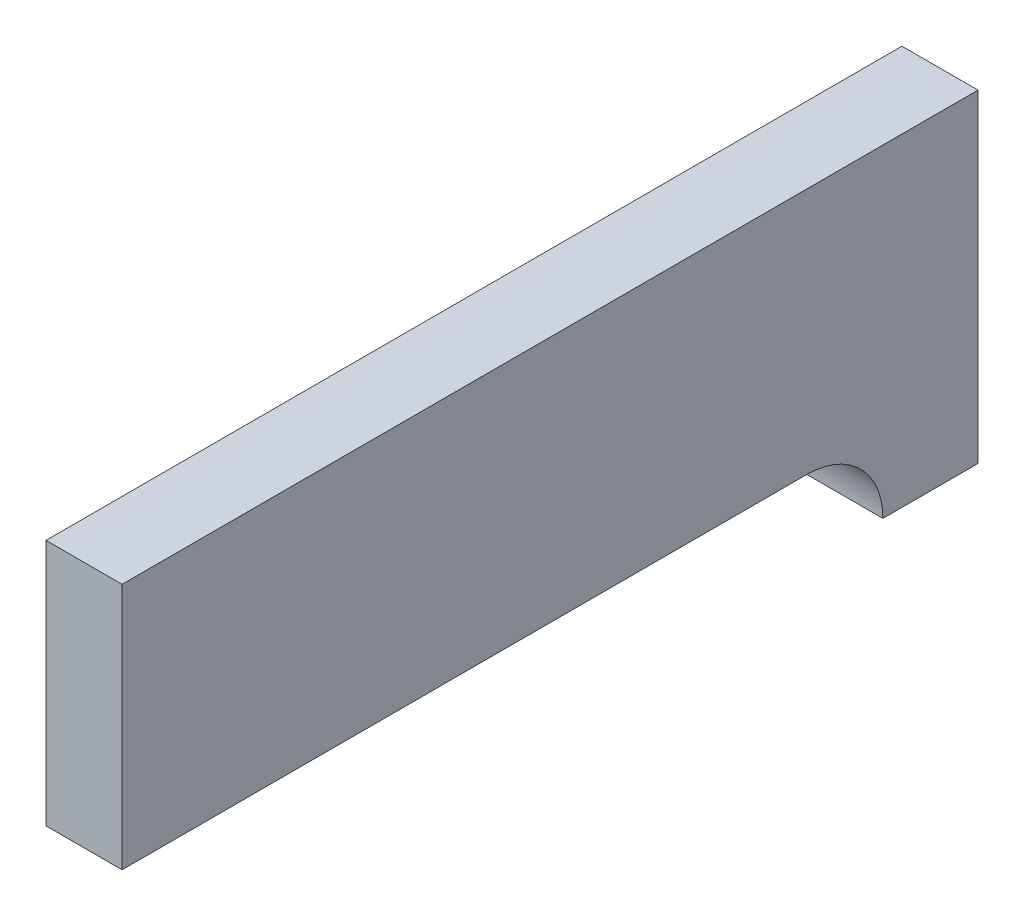
from build123d import *

# Parameters (mm, degrees)
SKETCH1_W            = 48
SKETCH1_H            = 53
BOSS_EXTRUDE1_DEPTH  = 10
SKETCH2_W            = 48
SKETCH2_H            = 5.616325
BOSS_EXTRUDE2_DEPTH  = 33.1917878
SKETCH4_W            = 4
SKETCH4_H            = 10
BOSS_EXTRUDE4_DEPTH  = 40
SKETCH5_W            = 48
SKETCH5_H            = 10.8609375
BOSS_EXTRUDE5_DEPTH  = 23.1917878
SKETCH6_W            = 48
SKETCH6_H            = 5
BOSS_EXTRUDE6_DEPTH  = 42.3
SKETCH7_W            = 12.8082122
SKETCH7_H            = 16.4772625
BOSS_EXTRUDE7_DEPTH  = 48
CUT_EXTRUDE1_REACH   = 84.426
SKETCH8_R            = 11.5
SKETCH8_R_2          = 2
FILLET1_R            = 10
FILLET2_R            = 4
SKETCH9_W            = 5
SKETCH9_H            = 16.4772625
BOSS_EXTRUDE9_DEPTH  = 48
CUT_EXTRUDE2_DEPTH   = 6
SKETCH11_R           = 1.9304
CUT_EXTRUDE3_DEPTH   = 6
BOSS_EXTRUDE11_DEPTH = 3
SKETCH14_W           = 146.253560905
SKETCH14_H           = 143.633383104
SKETCH14_W_2         = 45
SKETCH14_H_2         = 17
CUT_EXTRUDE5_DEPTH   = 90.10667764
SKETCH15_W           = 68.343124148
SKETCH15_H           = 38.24816948
CUT_EXTRUDE6_DEPTH   = 44


with BuildPart() as part:
    # Sketch1 → Boss-Extrude1 (new body)
    with BuildSketch(Plane.XY):
        with Locations((24, 26.5)):
            Rectangle(SKETCH1_W, SKETCH1_H)
    extrude(amount=BOSS_EXTRUDE1_DEPTH)

    # Sketch2 → Boss-Extrude2 (add)
    with BuildSketch(Plane(origin=(0, 0, 0), x_dir=(-1, 0, 0), z_dir=(0, 0, -1))):
        with Locations((-24, -2.8081625)):
            Rectangle(SKETCH2_W, SKETCH2_H)
    extrude(amount=-BOSS_EXTRUDE2_DEPTH)

    # Sketch4 → Boss-Extrude4 (add)
    with BuildSketch(Plane.XY.offset(10)):
        with Locations((2, 48)):
            Rectangle(SKETCH4_W, SKETCH4_H)
        with Locations((46, 48)):
            Rectangle(SKETCH4_W, SKETCH4_H)
    extrude(amount=BOSS_EXTRUDE4_DEPTH)

    # Sketch5 → Boss-Extrude5 (add)
    with BuildSketch(Plane.XY.offset(10)):
        with Locations((24, 5.43046875)):
            Rectangle(SKETCH5_W, SKETCH5_H)
    extrude(amount=BOSS_EXTRUDE5_DEPTH)

    # Sketch6 → Boss-Extrude6 (add)
    with BuildSketch(Plane.XZ.offset(5.616325)):
        with Locations((24, 30.6917878)):
            Rectangle(SKETCH6_W, SKETCH6_H)
    extrude(amount=BOSS_EXTRUDE6_DEPTH)

    # Sketch7 → Boss-Extrude7 (add)
    with BuildSketch(Plane.ZY):
        with Locations((-6.4041061, 2.62230625)):
            Rectangle(SKETCH7_W, SKETCH7_H)
    extrude(amount=-BOSS_EXTRUDE7_DEPTH)

    # Sketch8 → Cut-Extrude1 (cut, up to next)
    with BuildSketch(Plane(origin=(0, 0, 28.1917878), x_dir=(-1, 0, 0), z_dir=(0, 0, -1)), mode=Mode.PRIVATE) as cut_extrude1_sk1:
        with Locations((-24, -26.616325)):
            Circle(SKETCH8_R)
    cut_extrude1_tool1 = extrude(cut_extrude1_sk1.sketch, amount=-CUT_EXTRUDE1_REACH, mode=Mode.PRIVATE) & part.part
    # Sketch8 → Cut-Extrude1 (cut, up to next)
    with BuildSketch(Plane(origin=(0, 0, 28.1917878), x_dir=(-1, 0, 0), z_dir=(0, 0, -1)), mode=Mode.PRIVATE) as cut_extrude1_sk2:
        with Locations((-39.5, -11.116325)):
            Circle(SKETCH8_R_2)
    cut_extrude1_tool2 = extrude(cut_extrude1_sk2.sketch, amount=-CUT_EXTRUDE1_REACH, mode=Mode.PRIVATE) & part.part
    # Sketch8 → Cut-Extrude1 (cut, up to next)
    with BuildSketch(Plane(origin=(0, 0, 28.1917878), x_dir=(-1, 0, 0), z_dir=(0, 0, -1)), mode=Mode.PRIVATE) as cut_extrude1_sk3:
        with Locations((-39.5, -42.116325)):
            Circle(SKETCH8_R_2)
    cut_extrude1_tool3 = extrude(cut_extrude1_sk3.sketch, amount=-CUT_EXTRUDE1_REACH, mode=Mode.PRIVATE) & part.part
    # Sketch8 → Cut-Extrude1 (cut, up to next)
    with BuildSketch(Plane(origin=(0, 0, 28.1917878), x_dir=(-1, 0, 0), z_dir=(0, 0, -1)), mode=Mode.PRIVATE) as cut_extrude1_sk4:
        with Locations((-8.5, -11.116325)):
            Circle(SKETCH8_R_2)
    cut_extrude1_tool4 = extrude(cut_extrude1_sk4.sketch, amount=-CUT_EXTRUDE1_REACH, mode=Mode.PRIVATE) & part.part
    # Sketch8 → Cut-Extrude1 (cut, up to next)
    with BuildSketch(Plane(origin=(0, 0, 28.1917878), x_dir=(-1, 0, 0), z_dir=(0, 0, -1)), mode=Mode.PRIVATE) as cut_extrude1_sk5:
        with Locations((-8.5, -42.116325)):
            Circle(SKETCH8_R_2)
    cut_extrude1_tool5 = extrude(cut_extrude1_sk5.sketch, amount=-CUT_EXTRUDE1_REACH, mode=Mode.PRIVATE) & part.part
    add(cut_extrude1_tool1.solids().sort_by_distance((24, -26.616325, 28.191788))[0], mode=Mode.SUBTRACT)
    add(cut_extrude1_tool2.solids().sort_by_distance((39.5, -11.116325, 28.191788))[0], mode=Mode.SUBTRACT)
    add(cut_extrude1_tool3.solids().sort_by_distance((39.5, -42.116325, 28.191788))[0], mode=Mode.SUBTRACT)
    add(cut_extrude1_tool4.solids().sort_by_distance((8.5, -11.116325, 28.191788))[0], mode=Mode.SUBTRACT)
    add(cut_extrude1_tool5.solids().sort_by_distance((8.5, -42.116325, 28.191788))[0], mode=Mode.SUBTRACT)

    # Fillet1
    fillet1_edges = [part.edges().sort_by_distance(p)[0] for p in [
        (24, 10.8609375, 0),
    ]]
    fillet(fillet1_edges, radius=FILLET1_R)

    # Fillet2
    fillet2_edges = [part.edges().sort_by_distance(p)[0] for p in [
        (2, 43, 10),
        (46, 43, 10),
    ]]
    fillet(fillet2_edges, radius=FILLET2_R)

    # Sketch9 → Boss-Extrude9 (add)
    with BuildSketch(Plane(origin=(48, 0, 0), x_dir=(0, 0, -1), z_dir=(1, 0, 0))):
        with Locations((15.3082122, 2.62230625)):
            Rectangle(SKETCH9_W, SKETCH9_H)
    extrude(amount=-BOSS_EXTRUDE9_DEPTH)

    # Sketch10 → Cut-Extrude2 (cut)
    with BuildSketch(Plane.XY.offset(10)):
        Polygon((12.429, 36.979734073), (9, 38.959468146), (5.571, 36.979734073), (5.571, 33.020265927), (9, 31.040531854), (12.429, 33.020265927), align=None)
        Polygon((35.571, 36.979734073), (35.571, 33.020265927), (39, 31.040531854), (42.429, 33.020265927), (42.429, 36.979734073), (39, 38.959468146), align=None)
    extrude(amount=-CUT_EXTRUDE2_DEPTH, mode=Mode.SUBTRACT)

    # Sketch11 → Cut-Extrude3 (cut)
    with BuildSketch(Plane.XY.offset(4)):
        with Locations((9, 35)):
            Circle(SKETCH11_R)
        with Locations((39, 35)):
            Circle(SKETCH11_R)
    extrude(amount=-CUT_EXTRUDE3_DEPTH, mode=Mode.SUBTRACT)

    # Sketch12 → Boss-Extrude11 (add)
    with BuildSketch(Plane(origin=(0, 53, 0), x_dir=(1, 0, 0), z_dir=(0, 1, 0))):
        Polygon((0, 0), (0, -50), (4, -50), (4, -10), (44, -10), (44, -50), (48, -50), (48, 0), align=None)
    extrude(amount=BOSS_EXTRUDE11_DEPTH)

    # Sketch14 → Cut-Extrude5 (cut, through all)
    with BuildSketch(Plane.ZY):
        with Locations((21.574447485, 12.73606384)):
            Rectangle(SKETCH14_W, SKETCH14_H)
        with Locations((27.5, 47.5)):
            Rectangle(SKETCH14_W_2, SKETCH14_H_2, mode=Mode.SUBTRACT)
    extrude(amount=-CUT_EXTRUDE5_DEPTH, mode=Mode.SUBTRACT)

    # Sketch15 → Cut-Extrude6 (cut)
    with BuildSketch(Plane(origin=(48, 0, 0), x_dir=(0, 0, -1), z_dir=(1, 0, 0))):
        with Locations((-31.986382943, 43.740124775)):
            Rectangle(SKETCH15_W, SKETCH15_H)
    extrude(amount=-CUT_EXTRUDE6_DEPTH, mode=Mode.SUBTRACT)


solid = part.part
